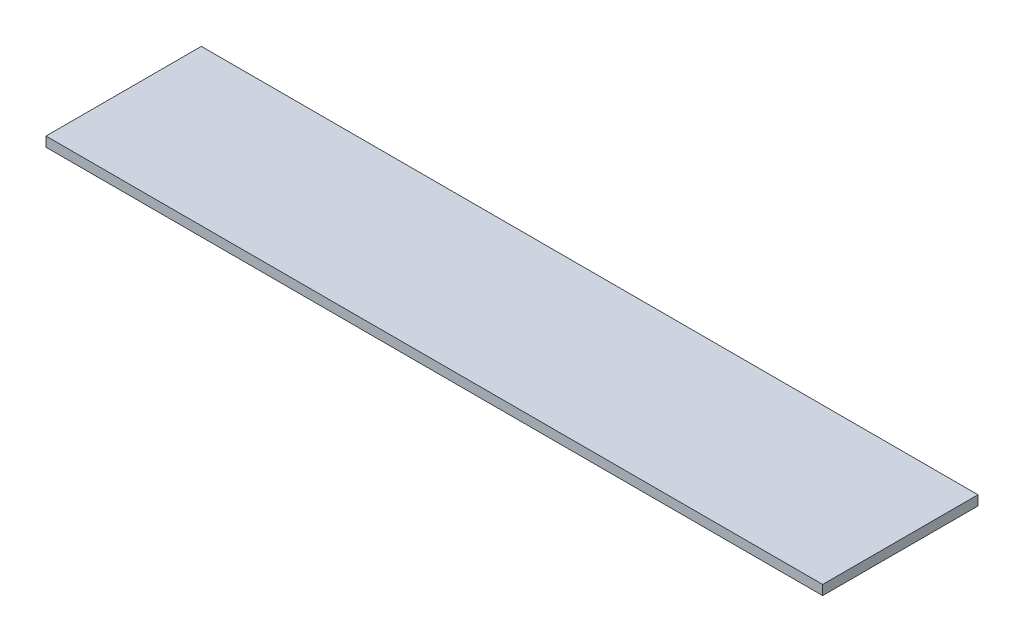
from build123d import *

# Parameters (mm, degrees)
SKETCH_1_W      = 40
SKETCH_1_H      = 8
EXTRUDE_1_DEPTH = 0.5


with BuildPart() as part:
    # 草图1 → 凸台-拉伸1 (new body)
    with BuildSketch(Plane(origin=(0, 0, 0), x_dir=(1, 0, 0), z_dir=(0, 1, 0))):
        with Locations((20, 0)):
            Rectangle(SKETCH_1_W, SKETCH_1_H)
    extrude(amount=EXTRUDE_1_DEPTH)


solid = part.part
